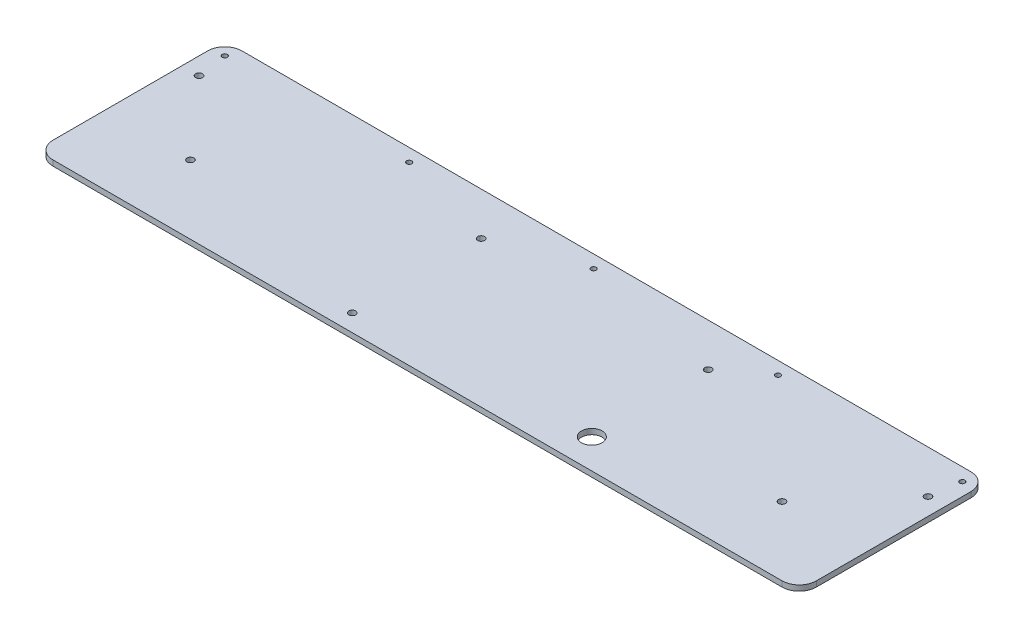
from build123d import *

# Parameters (mm, degrees)
SKETCH1_R           = 2
SKETCH1_R_2         = 6
SKETCH1_R_3         = 1.5
BOSS_EXTRUDE1_DEPTH = 3.175
FILLET1_R           = 10


with BuildPart() as part:
    # Sketch1 → Boss-Extrude1 (new body)
    with BuildSketch(Plane(origin=(0, 0, 0), x_dir=(1, 0, 0), z_dir=(0, 1, 0))):
        Polygon((417.700422465, 110), (-26.799577535, 110), (-26.799577535, 0), (417.700422465, 0), (417.700422465, 17.22815868), align=None)
        with Locations(Location((147.450422465, 10, 0), (0, 0, 270))):
            Circle(SKETCH1_R, mode=Mode.SUBTRACT)
        with Locations(Location((23.200422465, 40, 0), (0, 0, 270))):
            Circle(SKETCH1_R, mode=Mode.SUBTRACT)
        with Locations(Location((279.700422465, 17.22815868, 0), (0, 0, 270))):
            Circle(SKETCH1_R_2, mode=Mode.SUBTRACT)
        with Locations(Location((367.700422465, 40, 0), (0, 0, 270))):
            Circle(SKETCH1_R, mode=Mode.SUBTRACT)
        with Locations(Location((-16.799577535, 85, 0), (0, 0, 270))):
            Circle(SKETCH1_R, mode=Mode.SUBTRACT)
        with Locations(Location((-19.299577535, 102.5, 0), (0, 0, 270))):
            Circle(SKETCH1_R_3, mode=Mode.SUBTRACT)
        with Locations(Location((88.075422465, 102.5, 0), (0, 0, 270))):
            Circle(SKETCH1_R_3, mode=Mode.SUBTRACT)
        with Locations(Location((147.450422465, 85, 0), (0, 0, 270))):
            Circle(SKETCH1_R, mode=Mode.SUBTRACT)
        with Locations(Location((279.700422465, 85, 0), (0, 0, 270))):
            Circle(SKETCH1_R, mode=Mode.SUBTRACT)
        with Locations(Location((195.450422465, 102.5, 0), (0, 0, 270))):
            Circle(SKETCH1_R_3, mode=Mode.SUBTRACT)
        with Locations(Location((302.825422465, 102.5, 0), (0, 0, 270))):
            Circle(SKETCH1_R_3, mode=Mode.SUBTRACT)
        with Locations(Location((407.700422465, 85, 0), (0, 0, 270))):
            Circle(SKETCH1_R, mode=Mode.SUBTRACT)
        with Locations(Location((410.200422465, 102.5, 0), (0, 0, 270))):
            Circle(SKETCH1_R_3, mode=Mode.SUBTRACT)
    extrude(amount=BOSS_EXTRUDE1_DEPTH)

    # Fillet1
    fillet1_edges = [part.edges().sort_by_distance(p)[0] for p in [
        (-26.799577535, 1.5875, -110),
        (417.700422465, 1.5875, -110),
        (417.700422465, 1.5875, 0),
        (-26.799577535, 1.5875, 0),
    ]]
    fillet(fillet1_edges, radius=FILLET1_R)


solid = part.part
